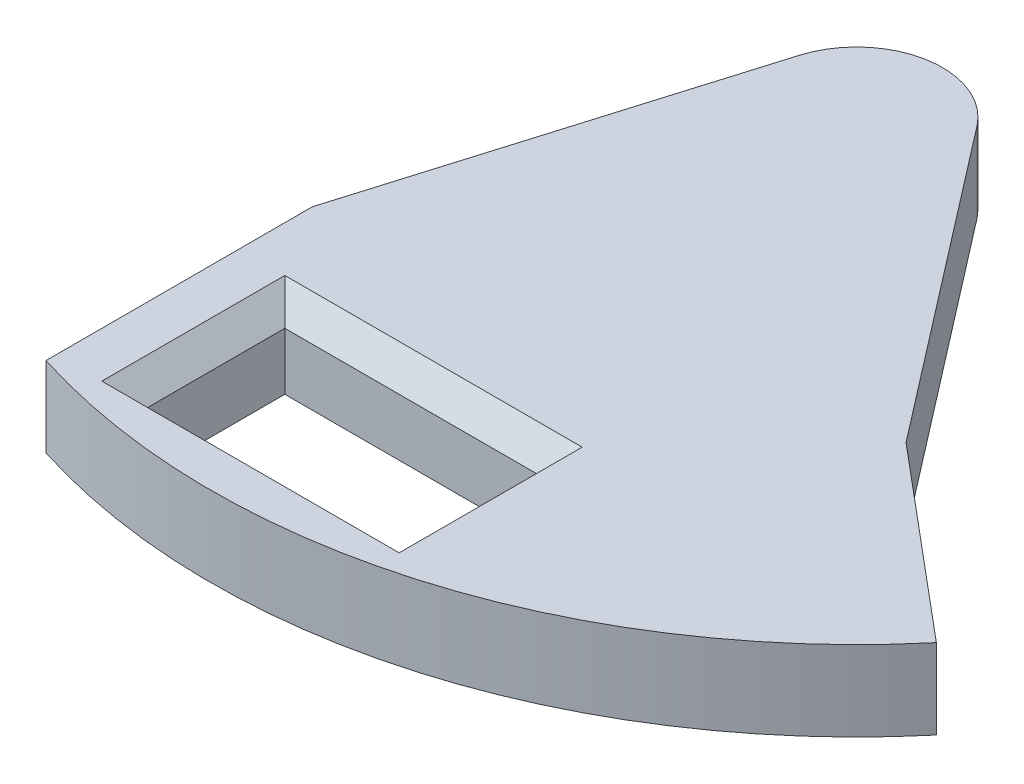
from build123d import *

# Parameters (mm, degrees)
SKETCH1_W           = 22
SKETCH1_H           = 12
BOSS_EXTRUDE1_DEPTH = 7
CHAMFER1_SIZE       = 2


with BuildPart() as part:
    # Sketch1 → Boss-Extrude1 (new body)
    with BuildSketch(Plane(origin=(0, 0, 0), x_dir=(1, 0, 0), z_dir=(0, 1, 0))):
        with BuildLine():
            Line((26.811555509, 22.502433661), (5.940065191, 49.578823596))
            ThreePointArc((5.940065191, 49.578823596), (-1.362951292, 52.375117882), (-7.184208043, 47.153405394))
            Line((-7.184208043, 47.153405394), (-17, 14.405882918))
            Line((-17, 14.405882918), (-17, -8.881815114))
            ThreePointArc((-17, -8.881815114), (15.805244301, -9.244301568), (43.281511036, 8.682500053))
            Line((43.281511036, 8.682500053), (26.811555509, 22.502433661))
        make_face()
        Rectangle(SKETCH1_W, SKETCH1_H, mode=Mode.SUBTRACT)
    extrude(amount=BOSS_EXTRUDE1_DEPTH)

    # Chamfer1
    chamfer1_edges = [part.edges().sort_by_distance(p)[0] for p in [
        (0, 7, -6),
        (11, 7, 0),
        (0, 7, 6),
        (-11, 7, 0),
    ]]
    chamfer(chamfer1_edges, length=CHAMFER1_SIZE)


solid = part.part
